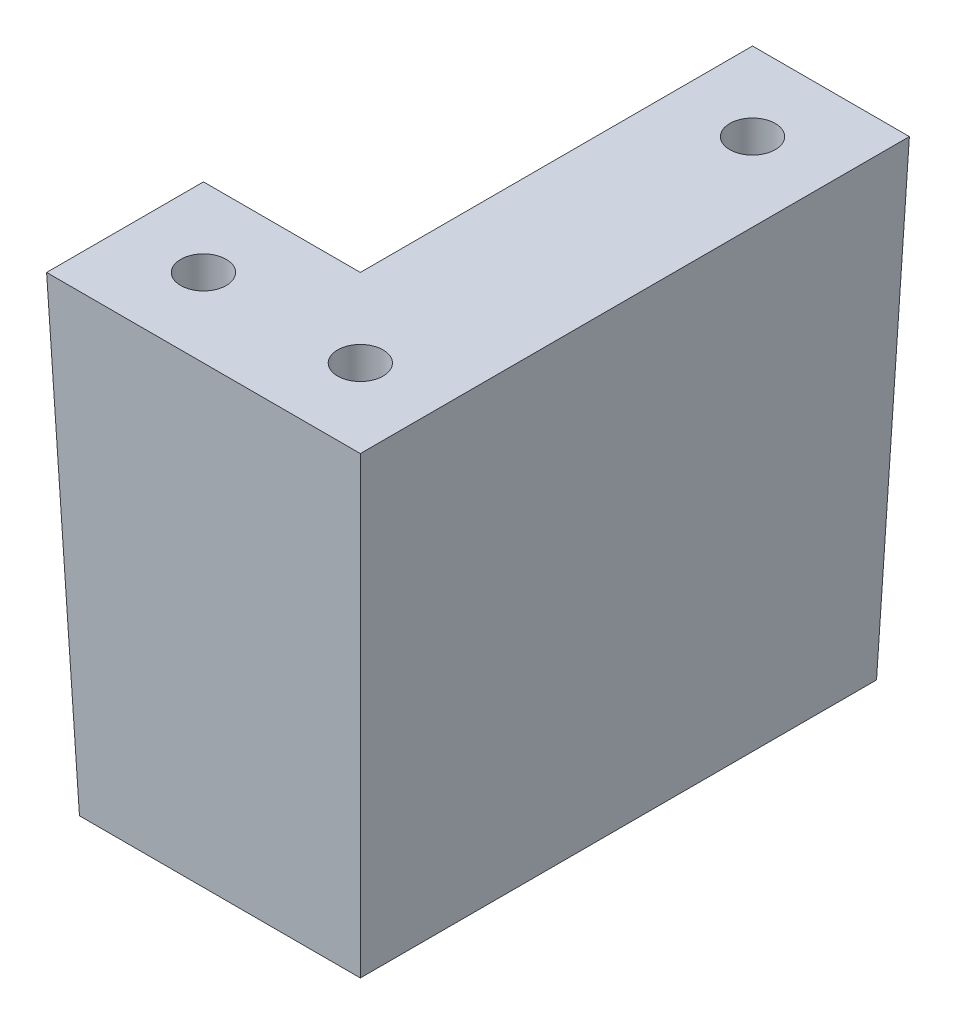
from build123d import *

# Parameters (mm, degrees)
BOSS_EXTRUDE1_DEPTH             = 60
BOSS_EXTRUDE1_DRAFT             = -2
CBORE_FOR_M5_SBHCS1_D           = 5.8
CBORE_FOR_M5_SBHCS1_CBORE_D     = 11.5
CBORE_FOR_M5_SBHCS1_CBORE_DEPTH = 55


with BuildPart() as part:
    # Sketch1 → Boss-Extrude1 (with draft: the straight prism first)
    with BuildSketch(Plane(origin=(0, 0, 0), x_dir=(1, 0, 0), z_dir=(0, 1, 0))):
        Polygon((0, 0), (40, 0), (40, 70), (20, 70), (20, 20), (0, 20), align=None)
    extrude(amount=-BOSS_EXTRUDE1_DEPTH)
    # Boss-Extrude1: the draft: its side faces are tilted about the plane it starts from
    boss_extrude1_sides = [part.faces().sort_by_distance(p)[0] for p in [
        (20, -30, 0),
        (40, -30, -35),
        (30, -30, -70),
        (20, -30, -45),
        (10, -30, -20),
        (0, -30, -10),
    ]]
    draft(boss_extrude1_sides, Plane(origin=(0, 0, 0), x_dir=(1, 0, 0), z_dir=(0, 1, 0)), BOSS_EXTRUDE1_DRAFT)

    # CBORE for M5 SBHCS1 (through all)
    with Locations(Plane(origin=(0, -60, 0), x_dir=(-1, 0, 0), z_dir=(0, -1, 0))):
        with Locations((-10, 10), (-30, 10), (-30.000000001, 60)):
            CounterBoreHole(CBORE_FOR_M5_SBHCS1_D / 2, CBORE_FOR_M5_SBHCS1_CBORE_D / 2, CBORE_FOR_M5_SBHCS1_CBORE_DEPTH)


solid = part.part
